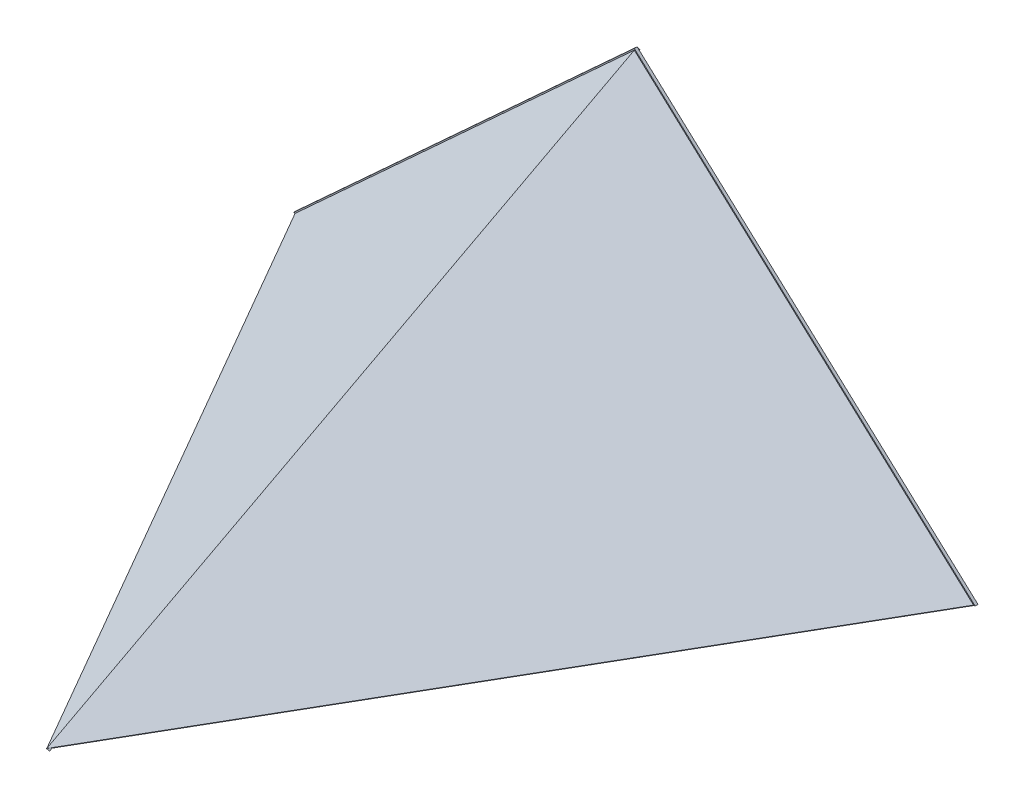
from build123d import *

# Parameters (mm, degrees)
BOSS_EXTRUDE1_DEPTH = 2.54
BOSS_EXTRUDE2_DEPTH = 2.54
BOSS_EXTRUDE3_DEPTH = 2.54


with BuildPart() as part:
    # Sketch6 → Boss-Extrude1 (new body)
    with BuildSketch(Plane(origin=(120.788646288, 131.769432314, 69.73735745), x_dir=(-0.7587184092087563, 0.44247091722357845, 0.47808562302066715), z_dir=(-0.6295142648161258, -0.6867428343448647, -0.3634502302502976))):
        Polygon((-231.257371127, -51.055743172), (252.395306061, -422.124803926), (123.626374272, 161.135037145), align=None)
    extrude(amount=BOSS_EXTRUDE1_DEPTH)

    # Sketch7 → Boss-Extrude2 (add)
    with BuildSketch(Plane(origin=(-120.788646288, 131.769432314, 69.73735745), x_dir=(-0.7587184092087562, -0.4424709172235786, -0.4780856230206672), z_dir=(0.629514264816126, -0.6867428343448646, -0.3634502302502976))):
        Polygon((231.257371127, -51.055743172), (-252.395306061, -422.124803926), (-123.626374272, 161.135037145), align=None)
    extrude(amount=BOSS_EXTRUDE2_DEPTH)

    # Sketch9 → Boss-Extrude3 (add)
    with BuildSketch(Plane.XY):
        Polygon((0, 279.4), (304.8, 0), (-304.8, 0), align=None)
    extrude(amount=BOSS_EXTRUDE3_DEPTH)


solid = part.part
